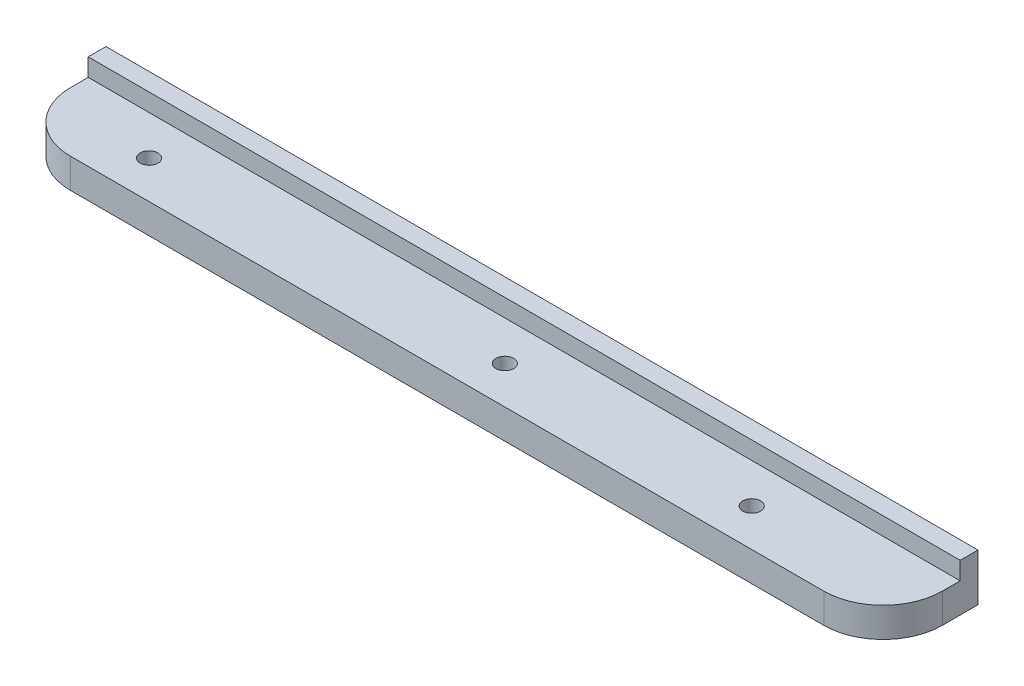
from build123d import *

# Parameters (mm, degrees)
SKETCH2_R           = 1.5
BOSS_EXTRUDE1_DEPTH = 5
SKETCH3_W           = 147
SKETCH3_H           = 3
BOSS_EXTRUDE2_DEPTH = 3
FILLET1_R           = 10
FILLET2_R           = 10
SKETCH4_W           = 194.268756053
SKETCH4_H           = 72.725923545
SKETCH4_W_2         = 127
SKETCH4_H_2         = 5
CUT_EXTRUDE1_DEPTH  = 10


with BuildPart() as part:
    # Sketch2 → Boss-Extrude1 (new body)
    with BuildSketch(Plane(origin=(0, 0, 0), x_dir=(1, 0, 0), z_dir=(0, 1, 0))):
        Polygon((79.832898172, 11.229765013), (51.332898172, 11.229765013), (9.722898172, 11.229765013), (-67.167101828, 11.229765013), (-67.167101828, 37.229765013), (79.832898172, 37.229765013), align=None)
        with Locations(Location((9.722898172, 17.579765013, 0), (0, 0, 270))):
            Circle(SKETCH2_R, mode=Mode.SUBTRACT)
        with Locations(Location((51.332898172, 17.579765013, 0), (0, 0, 270))):
            Circle(SKETCH2_R, mode=Mode.SUBTRACT)
        with Locations(Location((-50.267101828, 17.579765013, 0), (0, 0, 270))):
            Circle(SKETCH2_R, mode=Mode.SUBTRACT)
    extrude(amount=BOSS_EXTRUDE1_DEPTH)

    # Sketch3 → Boss-Extrude2 (add)
    with BuildSketch(Plane(origin=(0, 5, 0), x_dir=(1, 0, 0), z_dir=(0, 1, 0))):
        with Locations((6.332898172, 25.729765013)):
            Rectangle(SKETCH3_W, SKETCH3_H)
    extrude(amount=BOSS_EXTRUDE2_DEPTH)

    # Fillet1
    fillet1_edges = [part.edges().sort_by_distance(p)[0] for p in [
        (-67.167101828, 2.5, -37.229765013),
        (-67.167101828, 2.5, -11.229765013),
    ]]
    fillet(fillet1_edges, radius=FILLET1_R)

    # Fillet2
    fillet2_edges = [part.edges().sort_by_distance(p)[0] for p in [
        (79.832898172, 2.5, -37.229765013),
        (79.832898172, 2.5, -11.229765013),
    ]]
    fillet(fillet2_edges, radius=FILLET2_R)

    # Sketch4 → Cut-Extrude1 (cut)
    # profile 1 of 2: a face of its own
    with BuildSketch(Plane(origin=(0, 0, -37.229765013), x_dir=(-1, 0, 0), z_dir=(0, 0, -1))):
        with Locations((1.63687335, -5.593113251)):
            Rectangle(SKETCH4_W, SKETCH4_H)
        with Locations((-6.332898172, 2.5)):
            Rectangle(SKETCH4_W_2, SKETCH4_H_2, mode=Mode.SUBTRACT)
    # profile 2 of 2: a face of its own
    with BuildSketch(Plane(origin=(0, 0, -37.229765013), x_dir=(-1, 0, 0), z_dir=(0, 0, -1))):
        with Locations((-6.332898172, 2.5)):
            Rectangle(SKETCH4_W_2, SKETCH4_H_2)
    extrude(amount=-CUT_EXTRUDE1_DEPTH, mode=Mode.SUBTRACT)


solid = part.part
